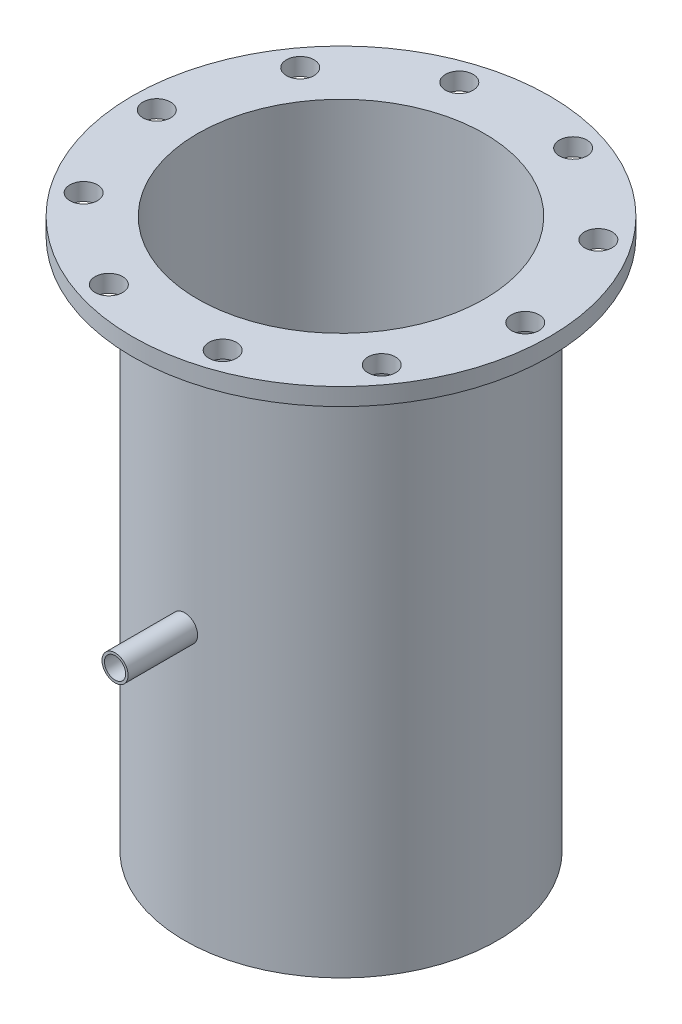
from build123d import *

# Parameters (mm, degrees)
TAP_DRILL_FOR_3_8_16_TAP1_D = 10.0838
CIRPATTERN1_COUNT           = 10
SKETCH4_R                   = 4.7625
SKETCH4_R_2                 = 3.8735
BOSS_EXTRUDE1_DEPTH         = 25.4


with BuildPart() as part:
    # Sketch1 → Revolve1 (revolve)
    with BuildSketch(Plane.XY, mode=Mode.PRIVATE) as revolve1_sk:
        Polygon((52.3875, 0), (52.3875, -170.805763516), (54.9275, -170.805763516), (54.9275, -175.606363516), (52.3875, -175.606363516), (52.3875, -179.416363516), (54.9275, -179.416363516), (54.9275, -184.216963516), (52.3875, -184.216963516), (52.3875, -188.026963516), (53.848, -188.026963516), (53.848, -191.074963516), (52.3875, -191.074963516), (52.3875, -200.599963516), (57.15, -200.599963516), (57.15, -8.89), (54.61, -6.35), (76.2, -6.35), (76.2, 0), align=None)
    revolve(revolve1_sk.sketch.rotate(Axis((0, 0, 0), (0, -1, 0)), 180), axis=Axis((0, 0, 0), (0, -1, 0)))

    # Tap Drill for 3/8-16 Tap1 (through all)
    with Locations(Plane(origin=(0, 0, 0), x_dir=(1, 0, 0), z_dir=(0, 1, 0))):
        with Locations((67.31, 0)):
            tap_drill_for_3_8_16_tap1 = Hole(TAP_DRILL_FOR_3_8_16_TAP1_D / 2)

    # CirPattern1: Tap Drill for 3/8-16 Tap1 ×10 about axis
    cirpattern1_axis = Axis((0, 0, 0), (0, 1, 0))
    for i in range(1, CIRPATTERN1_COUNT):
        add(tap_drill_for_3_8_16_tap1.rotate(cirpattern1_axis, i * 360 / CIRPATTERN1_COUNT), mode=Mode.SUBTRACT)

    # Sketch11 → 1/8 (0.125) Diameter Hole3 (revolve, cut)
    with BuildSketch(Plane(origin=(0, -101.6, 57.15), x_dir=(0, -1, 0), z_dir=(1, 0, 0))):
        Polygon((0, 0), (0, 26.353866233), (1.5875, 25.4), (1.5875, 0), align=None)
    revolve(axis=Axis((0, -101.6, 63.5), (0, 0, -1)), mode=Mode.SUBTRACT)


with BuildPart() as body_2:
    # Sketch4 → Boss-Extrude1 (new body)
    with BuildSketch(Plane.XY.offset(57.15)):
        with Locations((0, -101.6)):
            Circle(SKETCH4_R)
        with Locations((0, -101.6)):
            Circle(SKETCH4_R_2, mode=Mode.SUBTRACT)
    extrude(amount=BOSS_EXTRUDE1_DEPTH)


solid = Compound([part.part, body_2.part])
